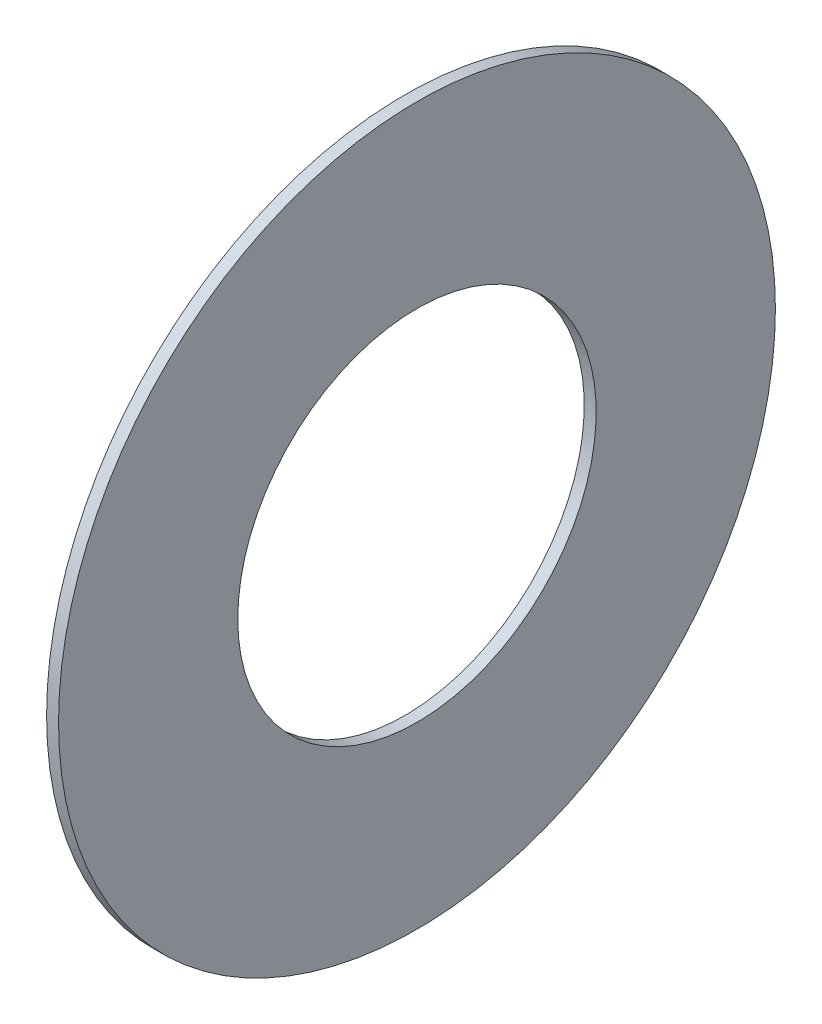
from build123d import *

# Parameters (mm, degrees)
SKETCH_1_R          = 30
EXTRUDE_1_DEPTH     = 1
SKETCH_2_R          = 15
CUT_EXTRUDE_1_DEPTH = 1


with BuildPart() as part:
    # 草图1 → 凸台-拉伸1 (new body)
    with BuildSketch(Plane(origin=(0, 0, 0), x_dir=(0, 0, -1), z_dir=(1, 0, 0))):
        Circle(SKETCH_1_R)
    extrude(amount=EXTRUDE_1_DEPTH)

    # 草图2 → 切除-拉伸1 (cut)
    with BuildSketch(Plane.ZY):
        Circle(SKETCH_2_R)
    extrude(amount=-CUT_EXTRUDE_1_DEPTH, mode=Mode.SUBTRACT)


solid = part.part
